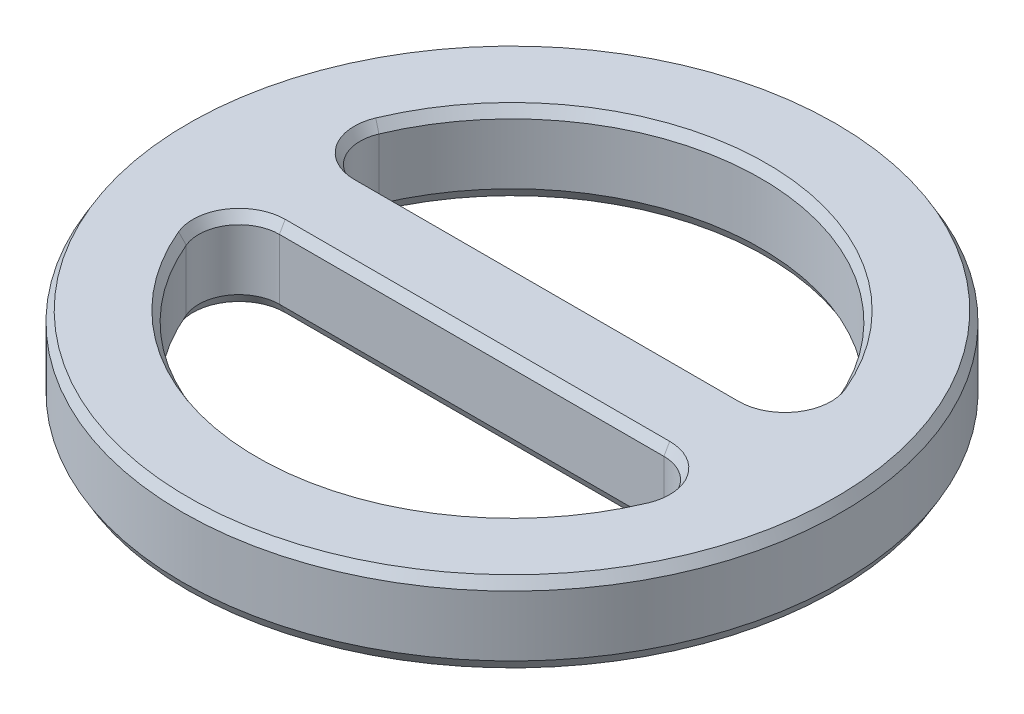
from build123d import *
from OCP.BRepFilletAPI import BRepFilletAPI_MakeChamfer

# Parameters (mm, degrees)
SKETCH1_R           = 98
BOSS_EXTRUDE1_DEPTH = 24
FILLET1_R           = 12
CHAMFER1_SIZE       = 3
CHAMFER1_SIZE2      = 1.732050808
CHAMFER2_SIZE       = 3
CHAMFER2_SIZE2      = 1.732050808


with BuildPart() as part:
    # Sketch1 → Boss-Extrude1 (new body)
    with BuildSketch(Plane(origin=(0, 0, 0), x_dir=(1, 0, 0), z_dir=(0, 1, 0))):
        with Locations(Location((0, 0, 0), (0, 0, 270))):
            Circle(SKETCH1_R)
        with BuildLine():
            Line((-73.020545054, 12), (73.020545054, 12))
            ThreePointArc((73.020545054, 12), (0, 74), (-73.020545054, 12))
        make_face(mode=Mode.SUBTRACT)
        with BuildLine():
            Line((73.020545054, -12), (-73.020545054, -12))
            ThreePointArc((-73.020545054, -12), (0, -74), (73.020545054, -12))
        make_face(mode=Mode.SUBTRACT)
    extrude(amount=BOSS_EXTRUDE1_DEPTH)

    # Fillet1
    fillet1_edges = [part.edges().sort_by_distance(p)[0] for p in [
        (-73.020545054, 12, 12),
        (73.020545054, 12, 12),
        (73.020545054, 12, -12),
        (-73.020545054, 12, -12),
    ]]
    fillet(fillet1_edges, radius=FILLET1_R)

    # Chamfer1: one chamfer whose edges measure the first distance from different faces: ONE call of the kernel's chamfer builder (chamfer() names one face for all edges)
    chamfer1_edges_1 = [part.edges().sort_by_distance(p)[0] for p in [
        (0, 0, 74),
    ]]
    chamfer1_side_1 = [part.faces().sort_by_distance(p)[0] for p in [
        (0, 12, 74),
    ]]
    chamfer1_edges_2 = [part.edges().sort_by_distance(p)[0] for p in [
        (0, 0, 12),
    ]]
    chamfer1_side_2 = [part.faces().sort_by_distance(p)[0] for p in [
        (0, 12, 12),
    ]]
    chamfer1_edges_3 = [part.edges().sort_by_distance(p)[0] for p in [
        (0, 0, -12),
    ]]
    chamfer1_side_3 = [part.faces().sort_by_distance(p)[0] for p in [
        (0, 12, -12),
    ]]
    chamfer1_edges_4 = [part.edges().sort_by_distance(p)[0] for p in [
        (0, 0, -74),
    ]]
    chamfer1_side_4 = [part.faces().sort_by_distance(p)[0] for p in [
        (0, 12, -74),
    ]]
    chamfer1_edges_5 = [part.edges().sort_by_distance(p)[0] for p in [
        (67.159970016, 0, 17.357031367),
    ]]
    chamfer1_side_5 = [part.faces().sort_by_distance(p)[0] for p in [
        (67.159970016, 12, 17.357031367),
    ]]
    chamfer1_edges_6 = [part.edges().sort_by_distance(p)[0] for p in [
        (67.159970016, 0, -17.357031367),
    ]]
    chamfer1_side_6 = [part.faces().sort_by_distance(p)[0] for p in [
        (67.159970016, 12, -17.357031367),
    ]]
    chamfer1_edges_7 = [part.edges().sort_by_distance(p)[0] for p in [
        (-67.159970016, 0, -17.357031367),
    ]]
    chamfer1_side_7 = [part.faces().sort_by_distance(p)[0] for p in [
        (-67.159970016, 12, -17.357031367),
    ]]
    chamfer1_edges_8 = [part.edges().sort_by_distance(p)[0] for p in [
        (-67.159970016, 0, 17.357031367),
    ]]
    chamfer1_side_8 = [part.faces().sort_by_distance(p)[0] for p in [
        (-67.159970016, 12, 17.357031367),
    ]]
    chamfer1_edges_9 = [part.edges().sort_by_distance(p)[0] for p in [
        (0, 24, -98),
    ]]
    chamfer1_side_9 = [part.faces().sort_by_distance(p)[0] for p in [
        (0, 12, -98),
    ]]
    chamfer1 = BRepFilletAPI_MakeChamfer(part.part.solid().wrapped)
    for e in chamfer1_edges_1:
        chamfer1.Add(CHAMFER1_SIZE, CHAMFER1_SIZE2, e.wrapped, chamfer1_side_1[0].wrapped)  # the first distance lies on this face
    for e in chamfer1_edges_2:
        chamfer1.Add(CHAMFER1_SIZE, CHAMFER1_SIZE2, e.wrapped, chamfer1_side_2[0].wrapped)  # the first distance lies on this face
    for e in chamfer1_edges_3:
        chamfer1.Add(CHAMFER1_SIZE, CHAMFER1_SIZE2, e.wrapped, chamfer1_side_3[0].wrapped)  # the first distance lies on this face
    for e in chamfer1_edges_4:
        chamfer1.Add(CHAMFER1_SIZE, CHAMFER1_SIZE2, e.wrapped, chamfer1_side_4[0].wrapped)  # the first distance lies on this face
    for e in chamfer1_edges_5:
        chamfer1.Add(CHAMFER1_SIZE, CHAMFER1_SIZE2, e.wrapped, chamfer1_side_5[0].wrapped)  # the first distance lies on this face
    for e in chamfer1_edges_6:
        chamfer1.Add(CHAMFER1_SIZE, CHAMFER1_SIZE2, e.wrapped, chamfer1_side_6[0].wrapped)  # the first distance lies on this face
    for e in chamfer1_edges_7:
        chamfer1.Add(CHAMFER1_SIZE, CHAMFER1_SIZE2, e.wrapped, chamfer1_side_7[0].wrapped)  # the first distance lies on this face
    for e in chamfer1_edges_8:
        chamfer1.Add(CHAMFER1_SIZE, CHAMFER1_SIZE2, e.wrapped, chamfer1_side_8[0].wrapped)  # the first distance lies on this face
    for e in chamfer1_edges_9:
        chamfer1.Add(CHAMFER1_SIZE, CHAMFER1_SIZE2, e.wrapped, chamfer1_side_9[0].wrapped)  # the first distance lies on this face
    add(Compound.cast(chamfer1.Shape()), mode=Mode.REPLACE)

    # Chamfer2: one chamfer whose edges measure the first distance from different faces: ONE call of the kernel's chamfer builder (chamfer() names one face for all edges)
    chamfer2_edges_1 = [part.edges().sort_by_distance(p)[0] for p in [
        (0, 0, -98),
    ]]
    chamfer2_side_1 = [part.faces().sort_by_distance(p)[0] for p in [
        (0, 10.5, -98),
    ]]
    chamfer2_edges_2 = [part.edges().sort_by_distance(p)[0] for p in [
        (0, 24, 74),
    ]]
    chamfer2_side_2 = [part.faces().sort_by_distance(p)[0] for p in [
        (0, 13.5, 74),
    ]]
    chamfer2_edges_3 = [part.edges().sort_by_distance(p)[0] for p in [
        (0, 24, 12),
    ]]
    chamfer2_side_3 = [part.faces().sort_by_distance(p)[0] for p in [
        (0, 13.5, 12),
    ]]
    chamfer2_edges_4 = [part.edges().sort_by_distance(p)[0] for p in [
        (0, 24, -12),
    ]]
    chamfer2_side_4 = [part.faces().sort_by_distance(p)[0] for p in [
        (0, 13.5, -12),
    ]]
    chamfer2_edges_5 = [part.edges().sort_by_distance(p)[0] for p in [
        (0, 24, -74),
    ]]
    chamfer2_side_5 = [part.faces().sort_by_distance(p)[0] for p in [
        (0, 13.5, -74),
    ]]
    chamfer2_edges_6 = [part.edges().sort_by_distance(p)[0] for p in [
        (67.159970016, 24, 17.357031367),
    ]]
    chamfer2_side_6 = [part.faces().sort_by_distance(p)[0] for p in [
        (67.159970016, 13.5, 17.357031367),
    ]]
    chamfer2_edges_7 = [part.edges().sort_by_distance(p)[0] for p in [
        (67.159970016, 24, -17.357031367),
    ]]
    chamfer2_side_7 = [part.faces().sort_by_distance(p)[0] for p in [
        (67.159970016, 13.5, -17.357031367),
    ]]
    chamfer2_edges_8 = [part.edges().sort_by_distance(p)[0] for p in [
        (-67.159970016, 24, -17.357031367),
    ]]
    chamfer2_side_8 = [part.faces().sort_by_distance(p)[0] for p in [
        (-67.159970016, 13.5, -17.357031367),
    ]]
    chamfer2_edges_9 = [part.edges().sort_by_distance(p)[0] for p in [
        (-67.159970016, 24, 17.357031367),
    ]]
    chamfer2_side_9 = [part.faces().sort_by_distance(p)[0] for p in [
        (-67.159970016, 13.5, 17.357031367),
    ]]
    chamfer2 = BRepFilletAPI_MakeChamfer(part.part.solid().wrapped)
    for e in chamfer2_edges_1:
        chamfer2.Add(CHAMFER2_SIZE, CHAMFER2_SIZE2, e.wrapped, chamfer2_side_1[0].wrapped)  # the first distance lies on this face
    for e in chamfer2_edges_2:
        chamfer2.Add(CHAMFER2_SIZE, CHAMFER2_SIZE2, e.wrapped, chamfer2_side_2[0].wrapped)  # the first distance lies on this face
    for e in chamfer2_edges_3:
        chamfer2.Add(CHAMFER2_SIZE, CHAMFER2_SIZE2, e.wrapped, chamfer2_side_3[0].wrapped)  # the first distance lies on this face
    for e in chamfer2_edges_4:
        chamfer2.Add(CHAMFER2_SIZE, CHAMFER2_SIZE2, e.wrapped, chamfer2_side_4[0].wrapped)  # the first distance lies on this face
    for e in chamfer2_edges_5:
        chamfer2.Add(CHAMFER2_SIZE, CHAMFER2_SIZE2, e.wrapped, chamfer2_side_5[0].wrapped)  # the first distance lies on this face
    for e in chamfer2_edges_6:
        chamfer2.Add(CHAMFER2_SIZE, CHAMFER2_SIZE2, e.wrapped, chamfer2_side_6[0].wrapped)  # the first distance lies on this face
    for e in chamfer2_edges_7:
        chamfer2.Add(CHAMFER2_SIZE, CHAMFER2_SIZE2, e.wrapped, chamfer2_side_7[0].wrapped)  # the first distance lies on this face
    for e in chamfer2_edges_8:
        chamfer2.Add(CHAMFER2_SIZE, CHAMFER2_SIZE2, e.wrapped, chamfer2_side_8[0].wrapped)  # the first distance lies on this face
    for e in chamfer2_edges_9:
        chamfer2.Add(CHAMFER2_SIZE, CHAMFER2_SIZE2, e.wrapped, chamfer2_side_9[0].wrapped)  # the first distance lies on this face
    add(Compound.cast(chamfer2.Shape()), mode=Mode.REPLACE)


solid = part.part
